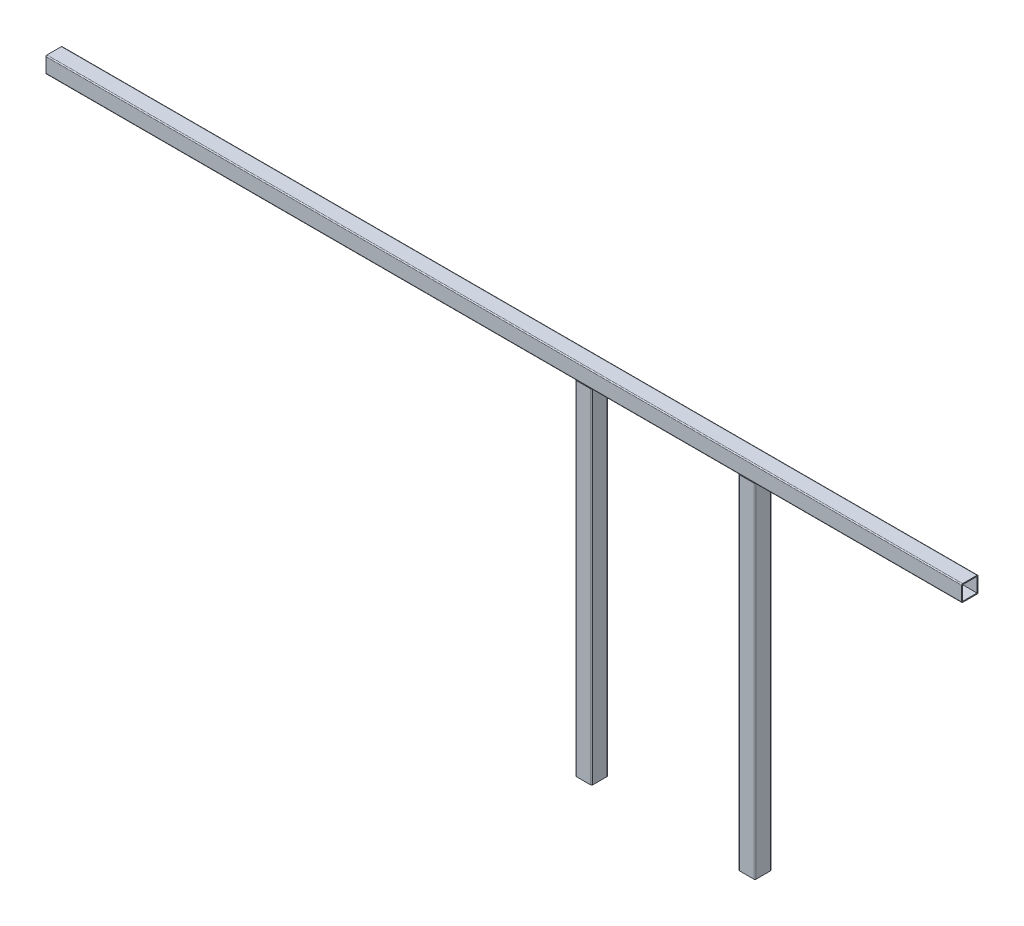
from build123d import *

# Parameters (mm, degrees)
F_8639_82_100_X_100_X_6_0_1_DEPTH   = 5605
F_8639_82_100_X_100_X_6_0_1_2_DEPTH = 2151
F_8639_82_100_X_100_X_6_0_1_3_DEPTH = 2151


with BuildPart() as part:
    # Sketch1 → Квадратная труба гост 8639-82 100 X 100 X 6.0(1) (new body)
    with BuildSketch(Plane.YZ):
        with BuildLine():
            Line((-43.999, -50), (43.999, -50))
            ThreePointArc((43.999, -50), (48.242347794, -48.242347794), (50, -43.999))
            Line((50, -43.999), (50, 43.999))
            ThreePointArc((50, 43.999), (48.242347794, 48.242347794), (43.999, 50))
            Line((43.999, 50), (-43.999, 50))
            ThreePointArc((-43.999, 50), (-48.242347794, 48.242347794), (-50, 43.999))
            Line((-50, 43.999), (-50, -43.999))
            ThreePointArc((-50, -43.999), (-48.242347794, -48.242347794), (-43.999, -50))
        make_face()
        with BuildLine():
            Line((-43.999, -44), (43.999, -44))
            ThreePointArc((43.999, -44), (43.999707107, -43.999707107), (44, -43.999))
            Line((44, -43.999), (44, 43.999))
            ThreePointArc((44, 43.999), (43.999707107, 43.999707107), (43.999, 44))
            Line((43.999, 44), (-43.999, 44))
            ThreePointArc((-43.999, 44), (-43.999707107, 43.999707107), (-44, 43.999))
            Line((-44, 43.999), (-44, -43.999))
            ThreePointArc((-44, -43.999), (-43.999707107, -43.999707107), (-43.999, -44))
        make_face(mode=Mode.SUBTRACT)
    extrude(amount=F_8639_82_100_X_100_X_6_0_1_DEPTH)


with BuildPart() as body_2:
    # Sketch1 on segment 2 (carried to segment 2) → 8639-82 100 X 100 X 6.0_1 2 (new body)
    with BuildSketch(Plane(origin=(3290, 1, 0), x_dir=(1, 0, 0), z_dir=(0, -1, 0))):
        with BuildLine():
            Line((-43.999, -50), (43.999, -50))
            ThreePointArc((43.999, -50), (48.242347794, -48.242347794), (50, -43.999))
            Line((50, -43.999), (50, 43.999))
            ThreePointArc((50, 43.999), (48.242347794, 48.242347794), (43.999, 50))
            Line((43.999, 50), (-43.999, 50))
            ThreePointArc((-43.999, 50), (-48.242347794, 48.242347794), (-50, 43.999))
            Line((-50, 43.999), (-50, -43.999))
            ThreePointArc((-50, -43.999), (-48.242347794, -48.242347794), (-43.999, -50))
        make_face()
        with BuildLine():
            Line((-43.999, -44), (43.999, -44))
            ThreePointArc((43.999, -44), (43.999707107, -43.999707107), (44, -43.999))
            Line((44, -43.999), (44, 43.999))
            ThreePointArc((44, 43.999), (43.999707107, 43.999707107), (43.999, 44))
            Line((43.999, 44), (-43.999, 44))
            ThreePointArc((-43.999, 44), (-43.999707107, 43.999707107), (-44, 43.999))
            Line((-44, 43.999), (-44, -43.999))
            ThreePointArc((-44, -43.999), (-43.999707107, -43.999707107), (-43.999, -44))
        make_face(mode=Mode.SUBTRACT)
    extrude(amount=F_8639_82_100_X_100_X_6_0_1_2_DEPTH)

    # 8639-82 100 X 100 X 6.0_1 2 end butt 1
    split(bisect_by=Plane(origin=(3290, -50, 0), x_dir=(1, 0, 0), z_dir=(0, -1, 0)), keep=Keep.TOP)


with BuildPart() as body_3:
    # Sketch1 on segment 3 (carried to segment 3) → 8639-82 100 X 100 X 6.0_1 3 (new body)
    with BuildSketch(Plane(origin=(4290, 1, 0), x_dir=(1, 0, 0), z_dir=(0, -1, 0))):
        with BuildLine():
            Line((-43.999, -50), (43.999, -50))
            ThreePointArc((43.999, -50), (48.242347794, -48.242347794), (50, -43.999))
            Line((50, -43.999), (50, 43.999))
            ThreePointArc((50, 43.999), (48.242347794, 48.242347794), (43.999, 50))
            Line((43.999, 50), (-43.999, 50))
            ThreePointArc((-43.999, 50), (-48.242347794, 48.242347794), (-50, 43.999))
            Line((-50, 43.999), (-50, -43.999))
            ThreePointArc((-50, -43.999), (-48.242347794, -48.242347794), (-43.999, -50))
        make_face()
        with BuildLine():
            Line((-43.999, -44), (43.999, -44))
            ThreePointArc((43.999, -44), (43.999707107, -43.999707107), (44, -43.999))
            Line((44, -43.999), (44, 43.999))
            ThreePointArc((44, 43.999), (43.999707107, 43.999707107), (43.999, 44))
            Line((43.999, 44), (-43.999, 44))
            ThreePointArc((-43.999, 44), (-43.999707107, 43.999707107), (-44, 43.999))
            Line((-44, 43.999), (-44, -43.999))
            ThreePointArc((-44, -43.999), (-43.999707107, -43.999707107), (-43.999, -44))
        make_face(mode=Mode.SUBTRACT)
    extrude(amount=F_8639_82_100_X_100_X_6_0_1_3_DEPTH)

    # 8639-82 100 X 100 X 6.0_1 3 end butt 1
    split(bisect_by=Plane(origin=(4290, -50, 0), x_dir=(1, 0, 0), z_dir=(0, -1, 0)), keep=Keep.TOP)


solid = Compound([part.part, body_2.part, body_3.part])
